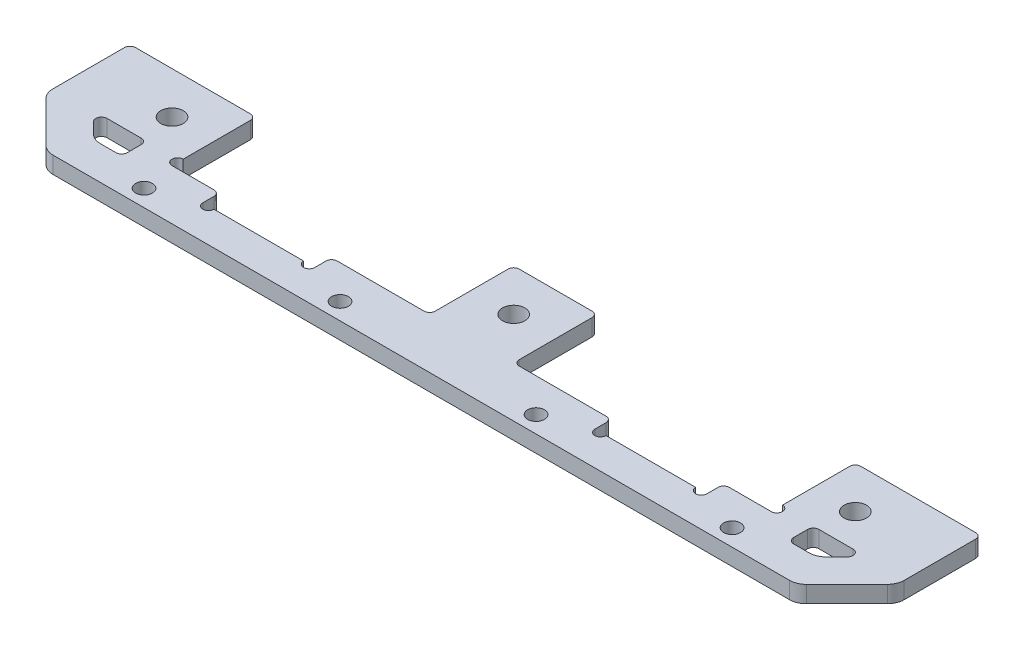
from build123d import *

# Parameters (mm, degrees)
SKETCH_1_R          = 2
SKETCH_1_R_2        = 1.5
EXTRUDE_1_DEPTH     = 3
SKETCH_2_W          = 20
SKETCH_2_H          = 3
CUT_EXTRUDE_1_DEPTH = 80.755877526
SKETCH_3_R          = 1
CUT_EXTRUDE_2_DEPTH = 80.755877526
FILLET_1_R          = 1
FILLET_2_R          = 3


with BuildPart() as part:
    # 草图1 → 凸台-拉伸1 (new body)
    with BuildSketch(Plane(origin=(0, 0, 0), x_dir=(1, 0, 0), z_dir=(0, 1, 0))):
        Polygon((-53.5, 24), (-53.5, 9), (-7.5, 9), (-7.5, 24), (7.5, 24), (7.5, 9), (53.5, 9), (53.5, 24), (76, 24), (76, 9), (67, 0), (-67, 0), (-76, 9), (-76, 24), align=None)
        with Locations(Location((-61, 16.5, 0), (0, 0, 270))):
            Circle(SKETCH_1_R, mode=Mode.SUBTRACT)
        with Locations(Location((-52.5, 3, 0), (0, 0, 270))):
            Circle(SKETCH_1_R_2, mode=Mode.SUBTRACT)
        with Locations(Location((-17.5, 3, 0), (0, 0, 270))):
            Circle(SKETCH_1_R_2, mode=Mode.SUBTRACT)
        with Locations(Location((0, 16.5, 0), (0, 0, 270))):
            Circle(SKETCH_1_R, mode=Mode.SUBTRACT)
        with Locations(Location((17.5, 3, 0), (0, 0, 90))):
            Circle(SKETCH_1_R_2, mode=Mode.SUBTRACT)
        with Locations(Location((52.5, 3, 0), (0, 0, 90))):
            Circle(SKETCH_1_R_2, mode=Mode.SUBTRACT)
        with Locations(Location((61, 16.5, 0), (0, 0, 90))):
            Circle(SKETCH_1_R, mode=Mode.SUBTRACT)
    extrude(amount=EXTRUDE_1_DEPTH)

    # 草图2 → 切除-拉伸1 (cut, through all)
    with BuildSketch(Plane(origin=(0, 3, 0), x_dir=(1, 0, 0), z_dir=(0, 1, 0))):
        with Locations((35, 7.5)):
            Rectangle(SKETCH_2_W, SKETCH_2_H)
        with Locations((-35, 7.5)):
            Rectangle(SKETCH_2_W, SKETCH_2_H)
        Polygon((-69.014718626, 10.5), (-59.5, 10.5), (-59.5, 6), (-64.514718626, 6), align=None)
        Polygon((64.514718626, 6), (59.5, 6), (59.5, 10.5), (69.014718626, 10.5), align=None)
    extrude(amount=-CUT_EXTRUDE_1_DEPTH, mode=Mode.SUBTRACT)

    # 草图3 → 切除-拉伸2 (cut, through all)
    with BuildSketch(Plane(origin=(0, 3, 0), x_dir=(1, 0, 0), z_dir=(0, 1, 0))):
        with Locations((-53.5, 10)):
            Circle(SKETCH_3_R)
        with Locations((-44, 6)):
            Circle(SKETCH_3_R)
        with Locations((-26, 6)):
            Circle(SKETCH_3_R)
        with Locations((26, 6)):
            Circle(SKETCH_3_R)
        with Locations((44, 6)):
            Circle(SKETCH_3_R)
        with Locations((53.5, 10)):
            Circle(SKETCH_3_R)
    extrude(amount=-CUT_EXTRUDE_2_DEPTH, mode=Mode.SUBTRACT)

    # 圆角1
    fillet_1_edges = [part.edges().sort_by_distance(p)[0] for p in [
        (45, 1.5, -9),
        (25, 1.5, -9),
        (-45, 1.5, -9),
        (-25, 1.5, -9),
        (-76, 1.5, -24),
        (-53.5, 1.5, -24),
        (-7.5, 1.5, -9),
        (-7.5, 1.5, -24),
        (7.5, 1.5, -24),
        (7.5, 1.5, -9),
        (53.5, 1.5, -24),
        (76, 1.5, -24),
        (69.014718626, 1.5, -10.5),
        (59.5, 1.5, -6),
        (59.5, 1.5, -10.5),
        (-59.5, 1.5, -6),
        (-69.014718626, 1.5, -10.5),
        (-59.5, 1.5, -10.5),
    ]]
    fillet(fillet_1_edges, radius=FILLET_1_R)

    # 圆角2
    fillet_2_edges = [part.edges().sort_by_distance(p)[0] for p in [
        (76, 1.5, -9),
        (67, 1.5, 0),
        (-67, 1.5, 0),
        (-76, 1.5, -9),
        (64.514718626, 1.5, -6),
        (-64.514718626, 1.5, -6),
    ]]
    fillet(fillet_2_edges, radius=FILLET_2_R)


solid = part.part
